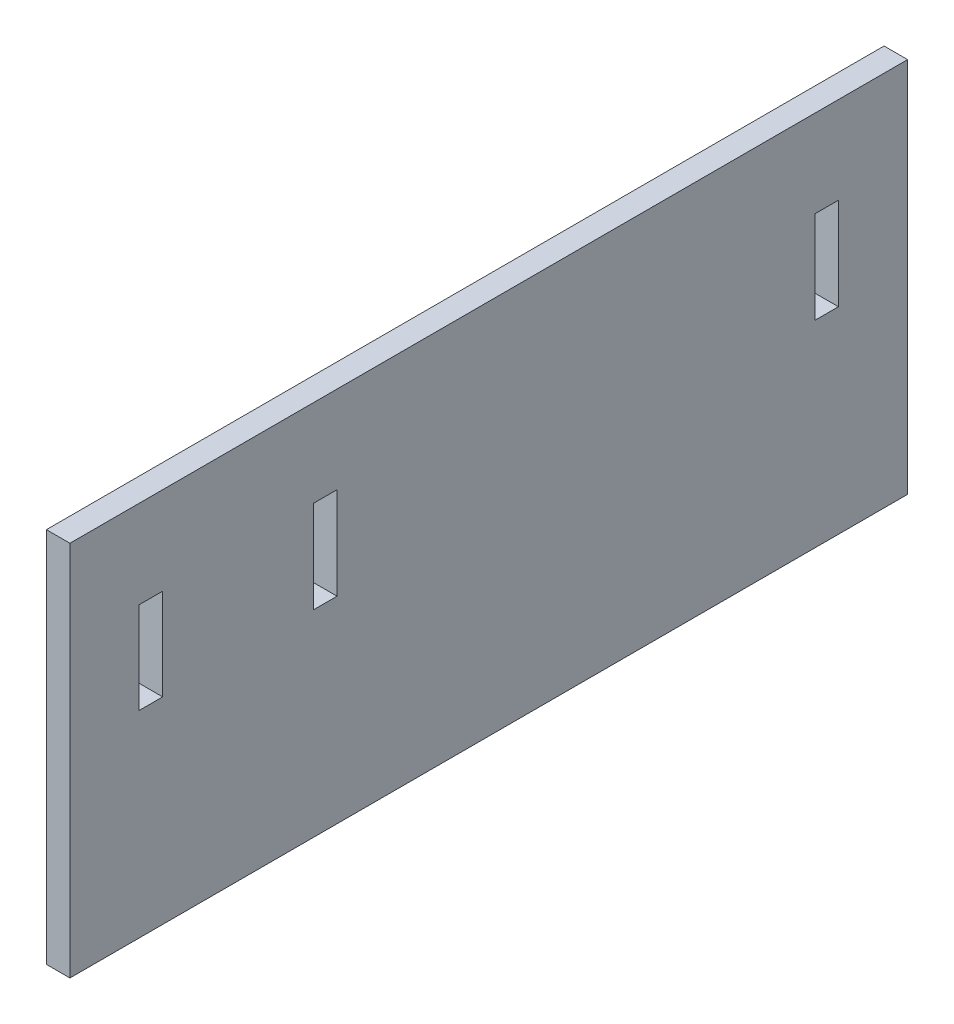
from build123d import *

# Parameters (mm, degrees)
SKETCH1_W   = 2.7
SKETCH1_H   = 10.5
SKETCH1_H_2 = 10.579195959
PANEL_DEPTH = 2.7


with BuildPart() as part:
    # Sketch1 → Panel (new body)
    with BuildSketch(Plane(origin=(0, 0, 0), x_dir=(0, 0, -1), z_dir=(1, 0, 0))):
        Polygon((3.2125, 30.5), (83.4125, 30.5), (94.9125, 30.5), (94.9125, -12.68), (86.975, -12.68), (6.775, -12.68), (-1.1625, -12.68), (-1.1625, 30.5), align=None)
        with Locations((8.125, 15.172642531)):
            Rectangle(SKETCH1_W, SKETCH1_H, mode=Mode.SUBTRACT)
        with Locations((85.625, 15.212240511)):
            Rectangle(SKETCH1_W, SKETCH1_H_2, mode=Mode.SUBTRACT)
        with Locations((28.125, 15.212240511)):
            Rectangle(SKETCH1_W, SKETCH1_H_2, mode=Mode.SUBTRACT)
    extrude(amount=PANEL_DEPTH)


solid = part.part
